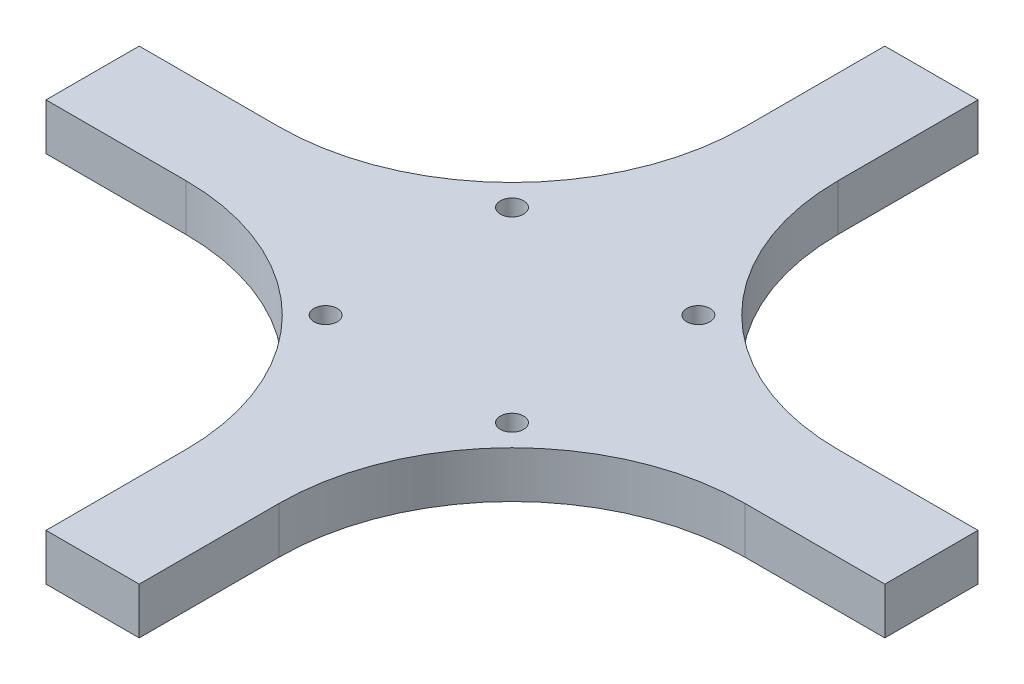
from build123d import *

# Parameters (mm, degrees)
BOSS_EXTRUDE1_DEPTH = 25.4
CUT_EXTRUDE1_REACH  = 326.285
SKETCH2_R           = 6.35


with BuildPart() as part:
    # Sketch1 → Boss-Extrude1 (new body)
    with BuildSketch(Plane(origin=(0, 0, 0), x_dir=(1, 0, 0), z_dir=(0, 1, 0))):
        with BuildLine():
            Line((-152.4, 25.4), (-228.6, 25.4))
            Line((-228.6, 25.4), (-228.6, -25.4))
            Line((-228.6, -25.4), (-152.4, -25.4))
            ThreePointArc((-152.4, -25.4), (-62.597438789, -62.597438789), (-25.4, -152.4))
            Line((-25.4, -152.4), (-25.4, -228.6))
            Line((-25.4, -228.6), (25.4, -228.6))
            Line((25.4, -228.6), (25.4, -152.4))
            ThreePointArc((25.4, -152.4), (62.597438789, -62.597438789), (152.4, -25.4))
            Line((152.4, -25.4), (228.6, -25.4))
            Line((228.6, -25.4), (228.6, 25.4))
            Line((228.6, 25.4), (152.4, 25.4))
            ThreePointArc((152.4, 25.4), (62.597438789, 62.597438789), (25.4, 152.4))
            Line((25.4, 152.4), (25.4, 228.6))
            Line((25.4, 228.6), (-25.4, 228.6))
            Line((-25.4, 228.6), (-25.4, 152.4))
            ThreePointArc((-25.4, 152.4), (-62.597438789, 62.597438789), (-152.4, 25.4))
        make_face()
    extrude(amount=BOSS_EXTRUDE1_DEPTH)

    # Sketch2 → Cut-Extrude1 (cut, up to next)
    with BuildSketch(Plane(origin=(0, 0, 0), x_dir=(-1, 0, 0), z_dir=(0, -1, 0)), mode=Mode.PRIVATE) as cut_extrude1_sk1:
        with Locations(Location((50.8, -50.8, 0), (0, 0, 90))):
            Circle(SKETCH2_R)
    cut_extrude1_tool1 = extrude(cut_extrude1_sk1.sketch, amount=-CUT_EXTRUDE1_REACH, mode=Mode.PRIVATE) & part.part
    # Sketch2 → Cut-Extrude1 (cut, up to next)
    with BuildSketch(Plane(origin=(0, 0, 0), x_dir=(-1, 0, 0), z_dir=(0, -1, 0)), mode=Mode.PRIVATE) as cut_extrude1_sk2:
        with Locations(Location((50.8, 50.8, 0), (0, 0, 90))):
            Circle(SKETCH2_R)
    cut_extrude1_tool2 = extrude(cut_extrude1_sk2.sketch, amount=-CUT_EXTRUDE1_REACH, mode=Mode.PRIVATE) & part.part
    # Sketch2 → Cut-Extrude1 (cut, up to next)
    with BuildSketch(Plane(origin=(0, 0, 0), x_dir=(-1, 0, 0), z_dir=(0, -1, 0)), mode=Mode.PRIVATE) as cut_extrude1_sk3:
        with Locations(Location((-50.8, 50.8, 0), (0, 0, 90))):
            Circle(SKETCH2_R)
    cut_extrude1_tool3 = extrude(cut_extrude1_sk3.sketch, amount=-CUT_EXTRUDE1_REACH, mode=Mode.PRIVATE) & part.part
    # Sketch2 → Cut-Extrude1 (cut, up to next)
    with BuildSketch(Plane(origin=(0, 0, 0), x_dir=(-1, 0, 0), z_dir=(0, -1, 0)), mode=Mode.PRIVATE) as cut_extrude1_sk4:
        with Locations(Location((-50.8, -50.8, 0), (0, 0, 90))):
            Circle(SKETCH2_R)
    cut_extrude1_tool4 = extrude(cut_extrude1_sk4.sketch, amount=-CUT_EXTRUDE1_REACH, mode=Mode.PRIVATE) & part.part
    add(cut_extrude1_tool1.solids().sort_by_distance((-50.8, 0, 50.8))[0], mode=Mode.SUBTRACT)
    add(cut_extrude1_tool2.solids().sort_by_distance((-50.8, 0, -50.8))[0], mode=Mode.SUBTRACT)
    add(cut_extrude1_tool3.solids().sort_by_distance((50.8, 0, -50.8))[0], mode=Mode.SUBTRACT)
    add(cut_extrude1_tool4.solids().sort_by_distance((50.8, 0, 50.8))[0], mode=Mode.SUBTRACT)


solid = part.part
